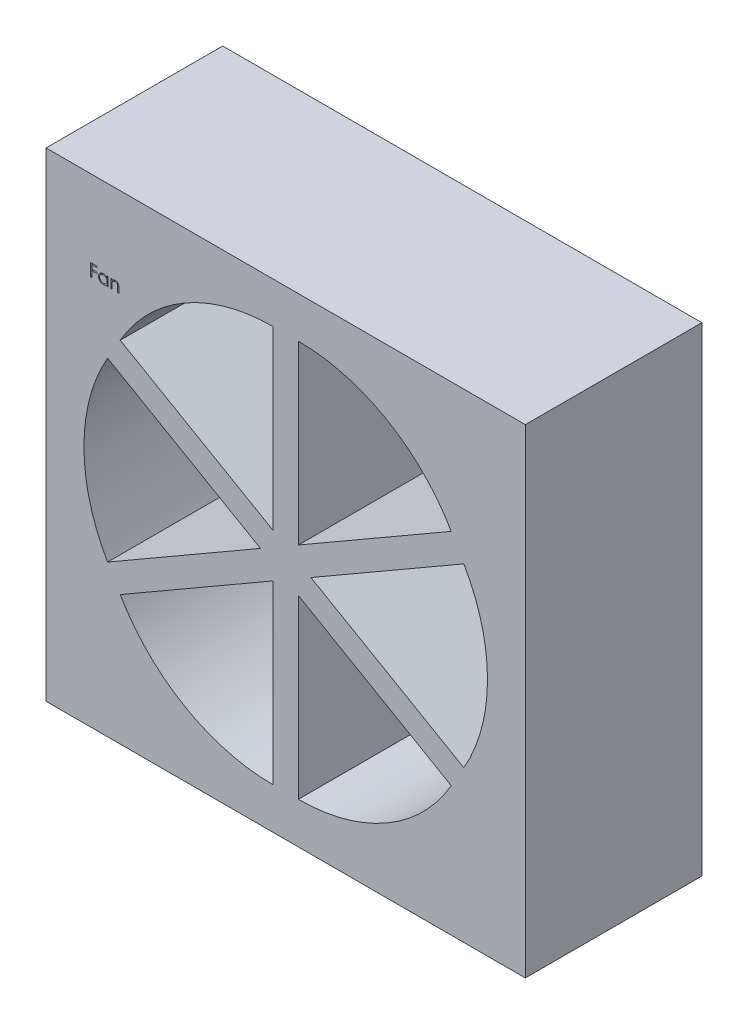
from build123d import *

# Parameters (mm, degrees)
SKETCH1_W           = 120.65
SKETCH1_H           = 120.65
BOSS_EXTRUDE1_DEPTH = 44.45
CUT_EXTRUDE1_DEPTH  = 3.175
CUT_EXTRUDE2_DEPTH  = 177.319731024


with BuildPart() as part:
    # Sketch1 → Boss-Extrude1 (new body)
    with BuildSketch(Plane.XY):
        with Locations((60.325, 60.325)):
            Rectangle(SKETCH1_W, SKETCH1_H)
    extrude(amount=BOSS_EXTRUDE1_DEPTH)

    # Sketch2 → Cut-Extrude1 (cut)
    # profile 1 of 3: a face of its own
    with BuildSketch(Plane.XY.offset(44.45)):
        Polygon((11.239986737, 101.279136985), (12.786781609, 101.279136985), (12.786781609, 100.953495959), (11.524922635, 100.953495959), (11.524922635, 99.976572882), (12.786781609, 99.976572882), (12.786781609, 99.650931857), (11.524922635, 99.650931857), (11.524922635, 98.104136985), (11.239986737, 98.104136985), align=None)
    # profile 2 of 3: a face of its own
    with BuildSketch(Plane.XY.offset(44.45)):
        with BuildLine():
            Line((15.636140583, 100.424329293), (15.636140583, 98.104136985))
            Line((15.636140583, 98.104136985), (15.351204686, 98.104136985))
            Line((15.351204686, 98.104136985), (15.351204686, 98.505464108))
            add(Edge.make_bspline(
                [(15.351204686, 98.505464108), (15.319074783, 98.469142477), (15.256372873, 98.398260356), (15.151651288, 98.305657242), (15.040645869, 98.22911405), (14.923895385, 98.167292341), (14.801505264, 98.120853833), (14.673746814, 98.087846389), (14.540567918, 98.066624838), (14.449624711, 98.064505733), (14.40353842, 98.063431857)],
                knots=[0, 0, 0, 0, 1.074387032, 2.096679803, 3.090159297, 4.057316773, 5.018401886, 5.985159533, 6.978961417, 8, 8, 8, 8], degree=3))
            add(Edge.make_bspline(
                [(14.40353842, 98.063431857), (14.362564633, 98.064544352), (14.281762512, 98.066738241), (14.16290042, 98.08375833), (14.048516737, 98.111091109), (13.938503374, 98.149101201), (13.833572214, 98.199520947), (13.732824841, 98.259883364), (13.636783184, 98.331766117), (13.546911145, 98.4139424), (13.464150688, 98.50320071), (13.391523676, 98.598401313), (13.330969097, 98.699132546), (13.280332309, 98.80411905), (13.241328482, 98.914169013), (13.214138114, 99.028901872), (13.197137852, 99.148181972), (13.19494487, 99.229407111), (13.193832891, 99.270593315)],
                knots=[0, 0, 0, 0, 1.033919861, 2.038935746, 3.024066025, 3.998881131, 4.97069526, 5.957263378, 6.95902576, 7.993208707, 9.027059324, 10.027763471, 11.009749337, 11.988697705, 12.965288445, 13.950418724, 14.960734635, 16, 16, 16, 16], degree=3))
            add(Edge.make_bspline(
                [(13.193832891, 99.270593315), (13.194969515, 99.310928246), (13.19721656, 99.390668229), (13.213956266, 99.507942476), (13.242105824, 99.620898327), (13.281609943, 99.729172126), (13.332266573, 99.832894886), (13.393887052, 99.932139965), (13.46647583, 100.027180776), (13.550161942, 100.115782532), (13.640817055, 100.197625518), (13.737798546, 100.268753723), (13.838693952, 100.330182579), (13.945068254, 100.378853947), (14.055346985, 100.418232206), (14.170511896, 100.445476398), (14.290083828, 100.461530397), (14.371264489, 100.46385519), (14.412442667, 100.465034421)],
                knots=[0, 0, 0, 0, 1.020392517, 2.01726096, 2.990465484, 3.961182959, 4.928053699, 5.906110375, 6.912531644, 7.948652711, 8.985773172, 9.998621852, 10.987621588, 11.969261332, 12.953316658, 13.946091881, 14.958173133, 16, 16, 16, 16], degree=3))
            add(Edge.make_bspline(
                [(14.412442667, 100.465034421), (14.459795396, 100.463730175), (14.552651863, 100.46117261), (14.688476557, 100.439888564), (14.816968334, 100.403930812), (14.939119067, 100.355019939), (15.054490118, 100.290024306), (15.161989254, 100.20803677), (15.262741514, 100.109574407), (15.321143636, 100.033945504), (15.351204686, 99.995017394)],
                knots=[0, 0, 0, 0, 1.038897134, 2.037228247, 3.008116434, 3.962042015, 4.918381754, 5.904844433, 6.921570401, 8, 8, 8, 8], degree=3))
            Line((15.351204686, 99.995017394), (15.351204686, 100.424329293))
            Line((15.351204686, 100.424329293), (15.636140583, 100.424329293))
        make_face()
        with BuildLine():
            add(Edge.make_bspline(
                [(14.416258772, 100.180098523), (14.374607909, 100.178616581), (14.292395729, 100.175691461), (14.171705813, 100.152855505), (14.056214359, 100.114860194), (13.946498991, 100.062897327), (13.844292823, 99.997556973), (13.752949279, 99.918525432), (13.671721257, 99.827958998), (13.603405903, 99.726266369), (13.547715952, 99.617247672), (13.508557288, 99.503288361), (13.482731613, 99.386443845), (13.480093169, 99.307193409), (13.478768789, 99.267413227)],
                knots=[0, 0, 0, 0, 1.031046209, 2.035121221, 3.029706178, 4.034933723, 5.034054252, 6.02443088, 7.017295772, 8.038157696, 9.050218397, 10.03989886, 11.016116709, 12, 12, 12, 12], degree=3))
            add(Edge.make_bspline(
                [(13.478768789, 99.267413227), (13.480460513, 99.227870773), (13.483837331, 99.148940857), (13.508104033, 99.031937048), (13.548816489, 98.917950881), (13.604371789, 98.807949837), (13.673937513, 98.705819975), (13.754572219, 98.613527149), (13.847055689, 98.534161594), (13.94949707, 98.467724652), (14.058905729, 98.414055794), (14.173962224, 98.376712678), (14.292503696, 98.352602834), (14.373105456, 98.34978663), (14.413714702, 98.348367754)],
                knots=[0, 0, 0, 0, 0.979072187, 1.954306742, 2.945804271, 3.96968567, 4.997920485, 5.998718438, 6.996577872, 8.005894225, 9.015743152, 10.005417472, 10.995077863, 12, 12, 12, 12], degree=3))
            add(Edge.make_bspline(
                [(14.413714702, 98.348367754), (14.454941172, 98.349873579), (14.536936533, 98.352868514), (14.657984504, 98.375802233), (14.775454934, 98.4136925), (14.887747634, 98.46621528), (14.992355839, 98.531309452), (15.086243199, 98.607515885), (15.165632685, 98.696146631), (15.232935981, 98.793552413), (15.285709394, 98.90033401), (15.324150534, 99.014030026), (15.346878006, 99.134644419), (15.349742517, 99.217070981), (15.351204686, 99.259144998)],
                knots=[0, 0, 0, 0, 1.01762866, 2.023962475, 3.030623092, 4.058876274, 5.077231937, 6.066672613, 7.034107872, 8.005628644, 8.981990164, 9.965428785, 10.961468474, 12, 12, 12, 12], degree=3))
            add(Edge.make_bspline(
                [(15.351204686, 99.259144998), (15.350334141, 99.291201458), (15.348620632, 99.354298717), (15.335530044, 99.446942965), (15.314706646, 99.535601417), (15.285364049, 99.620367285), (15.246818384, 99.700771906), (15.200329339, 99.777392602), (15.145079395, 99.849830873), (15.08195795, 99.91708923), (15.01286523, 99.978436092), (14.939754468, 100.033195082), (14.861759462, 100.078179183), (14.780191864, 100.115409479), (14.694910154, 100.145035994), (14.605220377, 100.164800545), (14.512075868, 100.178371693), (14.448534089, 100.179516853), (14.416258772, 100.180098523)],
                knots=[0, 0, 0, 0, 1.050140795, 2.067009409, 3.05949893, 4.030605086, 5.00011959, 5.97591094, 6.962425594, 7.979863591, 8.993523472, 9.986985069, 10.967611495, 11.937549037, 12.921786183, 13.919465291, 14.943216303, 16, 16, 16, 16], degree=3))
        make_face(mode=Mode.SUBTRACT)
    # profile 3 of 3: a face of its own
    with BuildSketch(Plane.XY.offset(44.45)):
        with BuildLine():
            Line((16.287422635, 100.424329293), (16.572358532, 100.424329293))
            Line((16.572358532, 100.424329293), (16.572358532, 100.005829693))
            add(Edge.make_bspline(
                [(16.572358532, 100.005829693), (16.602781958, 100.04378702), (16.661819678, 100.117444538), (16.760139752, 100.214255345), (16.864047433, 100.294034228), (16.972906393, 100.357628384), (17.08686441, 100.405567823), (17.20522684, 100.440189775), (17.328702324, 100.460949584), (17.412671491, 100.46366215), (17.455151, 100.465034421)],
                knots=[0, 0, 0, 0, 1.12780773, 2.188550248, 3.19190651, 4.159438251, 5.104880172, 6.052711206, 7.014878035, 8, 8, 8, 8], degree=3))
            add(Edge.make_bspline(
                [(17.455151, 100.465034421), (17.498086647, 100.463451279), (17.582122064, 100.460352689), (17.704475734, 100.435844691), (17.818751598, 100.393984352), (17.924542195, 100.336641974), (18.019907596, 100.265334673), (18.103659425, 100.182260543), (18.1729318, 100.086705667), (18.219375122, 99.998056804), (18.249969102, 99.919417684), (18.269229866, 99.852065275), (18.285586542, 99.777028095), (18.29976677, 99.694532896), (18.309361722, 99.60400168), (18.316929372, 99.50580556), (18.322352902, 99.399976341), (18.322568082, 99.326782044), (18.322679045, 99.289037826)],
                knots=[0, 0, 0, 0, 1.235846778, 2.418850247, 3.575807741, 4.728682307, 5.871620074, 6.994088408, 8.11269785, 9.256955736, 9.865816715, 10.540099792, 11.271859618, 12.076849838, 12.949306005, 13.892391288, 14.913166135, 16, 16, 16, 16], degree=3))
            Line((18.322679045, 99.289037826), (18.322679045, 98.104136985))
            Line((18.322679045, 98.104136985), (18.037743147, 98.104136985))
            Line((18.037743147, 98.104136985), (18.037743147, 99.195543235))
            add(Edge.make_bspline(
                [(18.037743147, 99.195543235), (18.03756788, 99.227132167), (18.037232624, 99.287556418), (18.036175216, 99.374069747), (18.03362632, 99.452525428), (18.030044636, 99.522735897), (18.02480223, 99.584633735), (18.019338843, 99.638345007), (18.012657756, 99.683801521), (18.006704257, 99.71116556), (18.004034213, 99.723437866)],
                knots=[0, 0, 0, 0, 1.430800155, 2.736877192, 3.918605307, 4.986035426, 5.920637409, 6.731861385, 7.431261377, 8, 8, 8, 8], degree=3))
            add(Edge.make_bspline(
                [(18.004034213, 99.723437866), (17.994395338, 99.759461584), (17.975843486, 99.828796095), (17.930001944, 99.922843544), (17.872113366, 100.0028519), (17.801448888, 100.068326497), (17.718691084, 100.119281471), (17.624069604, 100.154636415), (17.518497552, 100.176749174), (17.444243933, 100.178950929), (17.405541625, 100.180098523)],
                knots=[0, 0, 0, 0, 1.084156227, 2.086665306, 3.027808233, 3.945421172, 4.874247719, 5.839848303, 6.874090471, 8, 8, 8, 8], degree=3))
            add(Edge.make_bspline(
                [(17.405541625, 100.180098523), (17.382620226, 100.179666719), (17.337259371, 100.17881219), (17.269994753, 100.170238512), (17.204749253, 100.156215485), (17.140868064, 100.137284649), (17.079628851, 100.111283876), (17.019064101, 100.081775091), (16.961454393, 100.04499207), (16.905571312, 100.00399772), (16.853580408, 99.958568725), (16.805203986, 99.910631205), (16.762080211, 99.859581193), (16.72301077, 99.806241241), (16.689284774, 99.749878788), (16.659845187, 99.691037595), (16.634866378, 99.629640218), (16.622454221, 99.587027126), (16.616243748, 99.565705495)],
                knots=[0, 0, 0, 0, 1.023777757, 2.026029729, 3.023749952, 4.003683103, 4.997618607, 5.993177895, 7.010360494, 8.046726602, 9.087585522, 10.09234134, 11.086953743, 12.070360549, 13.043493632, 14.017870808, 15.008233677, 16, 16, 16, 16], degree=3))
            add(Edge.make_bspline(
                [(16.616243748, 99.565705495), (16.612669924, 99.55005256), (16.604889896, 99.515976941), (16.596486869, 99.460056647), (16.588859997, 99.395368312), (16.58247647, 99.321987425), (16.578570842, 99.239657066), (16.574312354, 99.148728842), (16.572761991, 99.048840178), (16.572496784, 98.979297071), (16.572358532, 98.943044237)],
                knots=[0, 0, 0, 0, 0.615963638, 1.340920617, 2.168419149, 3.115676021, 4.16674242, 5.331190069, 6.6087489, 8, 8, 8, 8], degree=3))
            Line((16.572358532, 98.943044237), (16.572358532, 98.104136985))
            Line((16.572358532, 98.104136985), (16.287422635, 98.104136985))
            Line((16.287422635, 98.104136985), (16.287422635, 100.424329293))
        make_face()
    extrude(amount=-CUT_EXTRUDE1_DEPTH, mode=Mode.SUBTRACT)

    # Sketch3 → Cut-Extrude2 (cut, through all)
    with BuildSketch(Plane.XY.offset(44.45)):
        with BuildLine():
            Line((66.675, 60.325), (105.169829198, 82.55))
            ThreePointArc((105.169829198, 82.55), (111.125, 60.325), (105.169829198, 38.1))
            Line((105.169829198, 38.1), (66.675, 60.325))
        make_face()
        with BuildLine():
            Line((63.5, 54.825738686), (101.994829198, 32.600738686))
            ThreePointArc((101.994829198, 32.600738686), (85.725, 16.330909488), (63.5, 10.375738686))
            Line((63.5, 10.375738686), (63.5, 54.825738686))
        make_face()
        with BuildLine():
            Line((57.15, 54.825738686), (57.15, 10.375738686))
            ThreePointArc((57.15, 10.375738686), (34.925, 16.330909488), (18.655170802, 32.600738686))
            Line((18.655170802, 32.600738686), (57.15, 54.825738686))
        make_face()
        with BuildLine():
            Line((53.975, 60.325), (15.480170802, 38.1))
            ThreePointArc((15.480170802, 38.1), (9.525, 60.325), (15.480170802, 82.55))
            Line((15.480170802, 82.55), (53.975, 60.325))
        make_face()
        with BuildLine():
            Line((57.15, 65.824261314), (18.655170802, 88.049261314))
            ThreePointArc((18.655170802, 88.049261314), (34.925, 104.319090512), (57.15, 110.274261314))
            Line((57.15, 110.274261314), (57.15, 65.824261314))
        make_face()
        with BuildLine():
            Line((63.5, 65.824261314), (63.5, 110.274261314))
            ThreePointArc((63.5, 110.274261314), (85.725, 104.319090512), (101.994829198, 88.049261314))
            Line((101.994829198, 88.049261314), (63.5, 65.824261314))
        make_face()
    extrude(amount=-CUT_EXTRUDE2_DEPTH, mode=Mode.SUBTRACT)


solid = part.part
